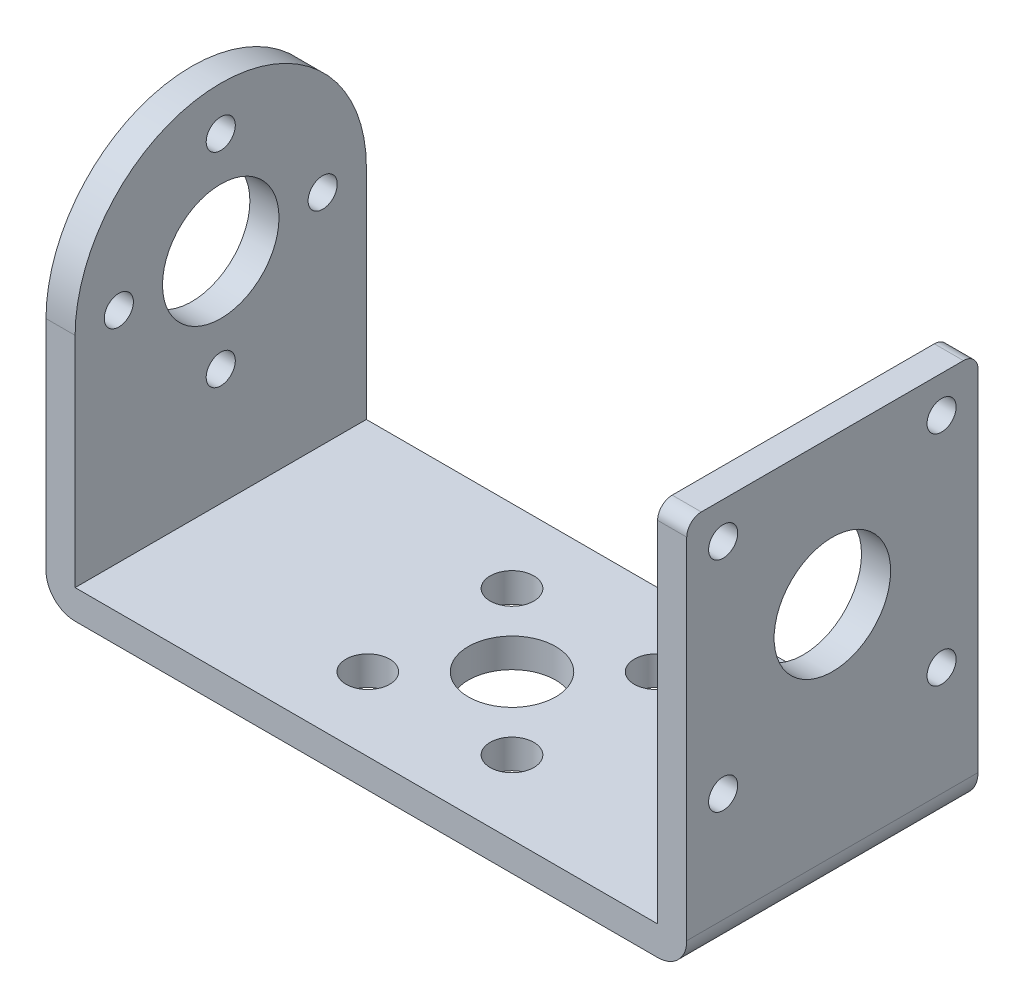
from build123d import *

# Parameters (mm, degrees)
SKETCH_1_W          = 40
SKETCH_1_H          = 20
SKETCH_1_R          = 3
SKETCH_1_R_2        = 1.5
EXTRUDE_1_DEPTH     = 2
SKETCH_2_W          = 2
SKETCH_2_H          = 20
EXTRUDE_2_DEPTH     = 27
SKETCH_3_R          = 4
SKETCH_3_R_2        = 1
CUT_EXTRUDE_1_DEPTH = 22
SKETCH_4_R          = 4
SKETCH_4_R_2        = 1
CUT_EXTRUDE_2_DEPTH = 37.235341864
FILLET_1_R          = 2
FILLET_2_R          = 1


with BuildPart() as part:
    # 草图1 → 凸台-拉伸1 (new body)
    with BuildSketch(Plane(origin=(0, 0, 0), x_dir=(1, 0, 0), z_dir=(0, 1, 0))):
        Rectangle(SKETCH_1_W, SKETCH_1_H)
        with Locations(Location((0, 0, 0), (0, 0, 270))):
            Circle(SKETCH_1_R, mode=Mode.SUBTRACT)
        with Locations(Location((-4.949747468, -4.949747468, 0), (0, 0, 270))):
            Circle(SKETCH_1_R_2, mode=Mode.SUBTRACT)
        with Locations(Location((-4.949747468, 4.949747468, 0), (0, 0, 270))):
            Circle(SKETCH_1_R_2, mode=Mode.SUBTRACT)
        with Locations(Location((4.949747468, 4.949747468, 0), (0, 0, 270))):
            Circle(SKETCH_1_R_2, mode=Mode.SUBTRACT)
        with Locations(Location((4.949747468, -4.949747468, 0), (0, 0, 270))):
            Circle(SKETCH_1_R_2, mode=Mode.SUBTRACT)
    extrude(amount=EXTRUDE_1_DEPTH)

    # 草图2 → 凸台-拉伸2 (add)
    with BuildSketch(Plane(origin=(0, 0, 0), x_dir=(1, 0, 0), z_dir=(0, 1, 0))):
        with Locations((21, 0)):
            Rectangle(SKETCH_2_W, SKETCH_2_H)
        with Locations((-21, 0)):
            Rectangle(SKETCH_2_W, SKETCH_2_H)
    extrude(amount=EXTRUDE_2_DEPTH)

    # 草图3 → 切除-拉伸1 (cut)
    with BuildSketch(Plane(origin=(0, 0, 0), x_dir=(0, 0, -1), z_dir=(1, 0, 0))):
        with BuildLine():
            Line((-10, 27), (-10, 17))
            ThreePointArc((-10, 17), (-7.071067827, 24.071067797), (-4.3e-08, 27))
            Line((-4.3e-08, 27), (-10, 27))
        make_face()
        with BuildLine():
            ThreePointArc((-4.3e-08, 27), (7.071067797, 24.071067827), (10, 17))
            Line((10, 17), (10, 27))
            Line((10, 27), (-4.3e-08, 27))
        make_face()
        with Locations((0, 17)):
            Circle(SKETCH_3_R)
        with Locations((0, 10)):
            Circle(SKETCH_3_R_2)
        with Locations((7, 17)):
            Circle(SKETCH_3_R_2)
        with Locations((0, 24)):
            Circle(SKETCH_3_R_2)
        with Locations((-7, 17)):
            Circle(SKETCH_3_R_2)
    extrude(amount=-CUT_EXTRUDE_1_DEPTH, mode=Mode.SUBTRACT)

    # 草图4 → 切除-拉伸2 (cut, through all)
    with BuildSketch(Plane(origin=(0, 0, 0), x_dir=(0, 0, -1), z_dir=(1, 0, 0))):
        with Locations((0, 17)):
            Circle(SKETCH_4_R)
        with Locations((-7.5, 24.5)):
            Circle(SKETCH_4_R_2)
        with Locations(Location((-7.5, 9.5, 0), (0, 0, 180))):
            Circle(SKETCH_4_R_2)
        with Locations((7.5, 9.5)):
            Circle(SKETCH_4_R_2)
        with Locations(Location((7.5, 24.5, 0), (0, 0, 180))):
            Circle(SKETCH_4_R_2)
    extrude(amount=CUT_EXTRUDE_2_DEPTH, mode=Mode.SUBTRACT)

    # 圆角1
    fillet_1_edges = [part.edges().sort_by_distance(p)[0] for p in [
        (22, 0, 0),
        (-22, 0, 0),
    ]]
    fillet(fillet_1_edges, radius=FILLET_1_R)

    # 圆角2
    fillet_2_edges = [part.edges().sort_by_distance(p)[0] for p in [
        (21, 27, 10),
        (21, 27, -10),
    ]]
    fillet(fillet_2_edges, radius=FILLET_2_R)


solid = part.part
